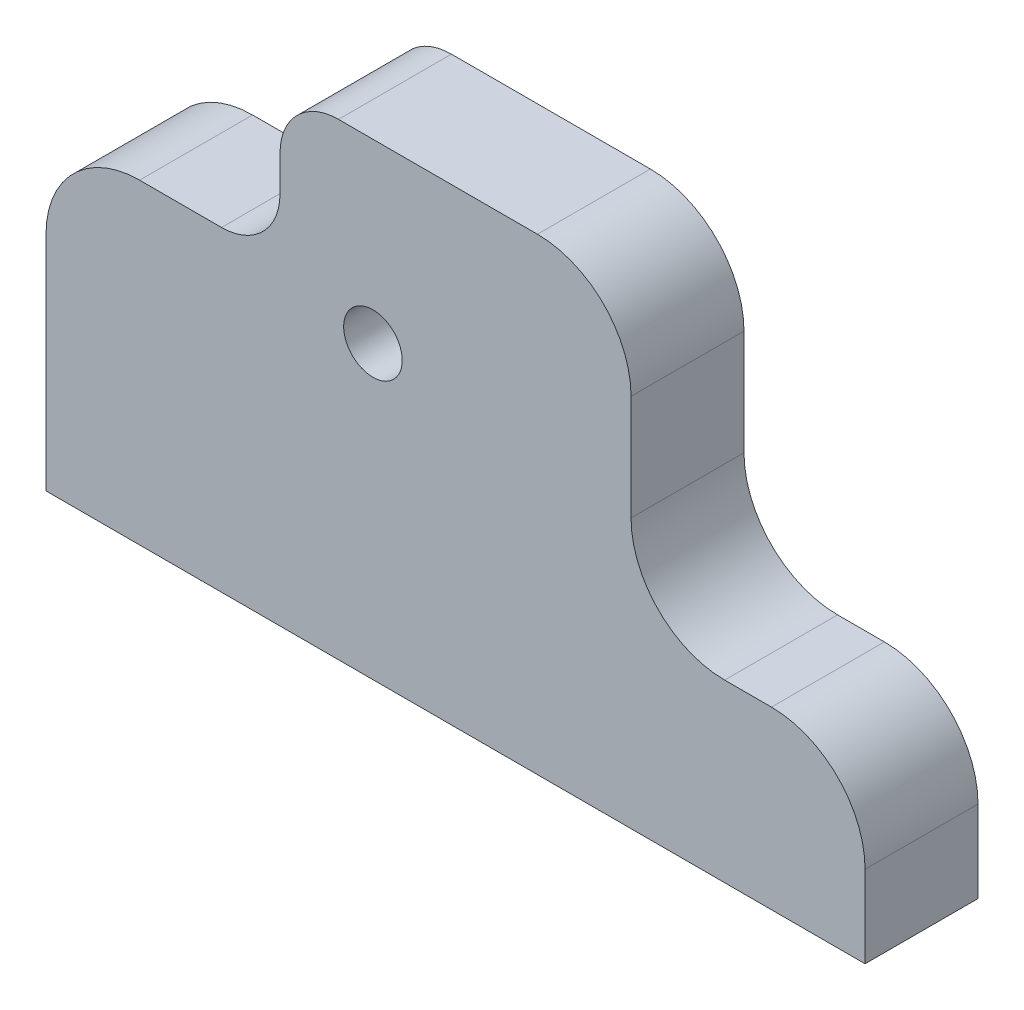
from build123d import *

# Parameters (mm, degrees)
BOSS_EXTRUDE1_DEPTH       = 4.826
M3X0_5_TAPPED_HOLE2_D     = 2.5
M3X0_5_TAPPED_HOLE3_D     = 2.5
M3X0_5_TAPPED_HOLE3_DEPTH = 5
M3X0_5_TAPPED_HOLE3_TIP   = 0.751075774
FILLET1_R                 = 2.5
FILLET2_R                 = 4


with BuildPart() as part:
    # Sketch1 → Boss-Extrude1 (new body)
    with BuildSketch(Plane.XY):
        Polygon((0, 0), (0, 13.5), (10, 13.5), (10, 20), (25, 20), (25, 7.5), (35, 7.5), (35, 0), align=None)
    extrude(amount=BOSS_EXTRUDE1_DEPTH)

    # M3x0.5 Tapped Hole2 (through all)
    with Locations(Plane.XY.offset(4.826)):
        with Locations((13.97024649, 12.44)):
            Hole(M3X0_5_TAPPED_HOLE2_D / 2)

    # M3x0.5 Tapped Hole3
    with Locations(Plane(origin=(0, 0, 0), x_dir=(-1, 0, 0), z_dir=(0, -1, 0))):
        with Locations((-16.73, -2.413), (-28.73, -2.413)):
            Hole(M3X0_5_TAPPED_HOLE3_D / 2, depth=M3X0_5_TAPPED_HOLE3_DEPTH)
            with Locations((0, 0, -(M3X0_5_TAPPED_HOLE3_DEPTH + M3X0_5_TAPPED_HOLE3_TIP / 2))):  # 118° drill point
                Cone(0, M3X0_5_TAPPED_HOLE3_D / 2, M3X0_5_TAPPED_HOLE3_TIP, mode=Mode.SUBTRACT)

    # Fillet1
    fillet1_edges = [part.edges().sort_by_distance(p)[0] for p in [
        (10, 20, 2.413),
        (10, 13.5, 2.413),
    ]]
    fillet(fillet1_edges, radius=FILLET1_R)

    # Fillet2
    fillet2_edges = [part.edges().sort_by_distance(p)[0] for p in [
        (25, 20, 2.413),
        (25, 7.5, 2.413),
        (35, 7.5, 2.413),
        (0, 13.5, 2.413),
    ]]
    fillet(fillet2_edges, radius=FILLET2_R)


solid = part.part
